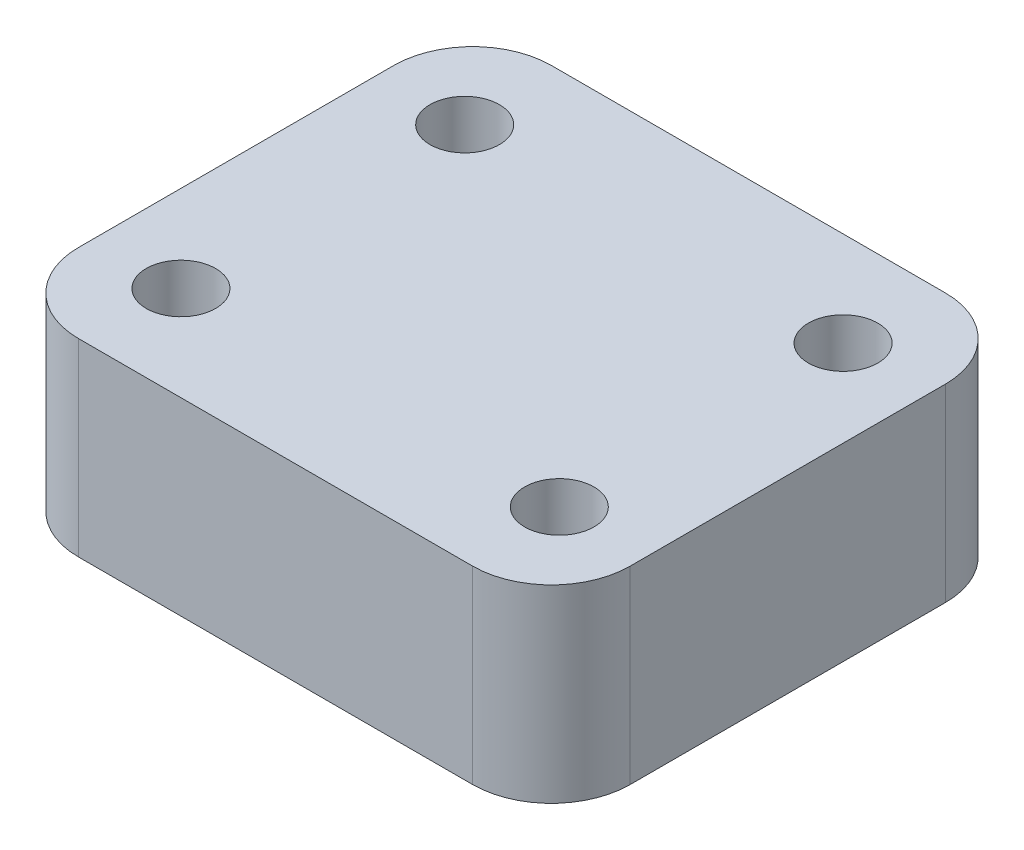
from build123d import *

# Parameters (mm, degrees)
SKETCH1_W           = 35
SKETCH1_H           = 30
BOSS_EXTRUDE1_DEPTH = 12
SKETCH2_R           = 2.2
CUT_EXTRUDE1_DEPTH  = 26.98557292
FILLET1_R           = 5


with BuildPart() as part:
    # Sketch1 → Boss-Extrude1 (new body)
    with BuildSketch(Plane(origin=(0, 0, 0), x_dir=(1, 0, 0), z_dir=(0, 1, 0))):
        Rectangle(SKETCH1_W, SKETCH1_H)
    extrude(amount=BOSS_EXTRUDE1_DEPTH)

    # Sketch2 → Cut-Extrude1 (cut, through all)
    with BuildSketch(Plane(origin=(0, 12, 0), x_dir=(1, 0, 0), z_dir=(0, 1, 0))):
        with Locations(Location((-12, 9, 0), (0, 0, 270))):
            Circle(SKETCH2_R)
        with Locations(Location((12, 9, 0), (0, 0, 270))):
            Circle(SKETCH2_R)
        with Locations(Location((12, -9, 0), (0, 0, 270))):
            Circle(SKETCH2_R)
        with Locations(Location((-12, -9, 0), (0, 0, 270))):
            Circle(SKETCH2_R)
    extrude(amount=-CUT_EXTRUDE1_DEPTH, mode=Mode.SUBTRACT)

    # Fillet1
    fillet1_edges = [part.edges().sort_by_distance(p)[0] for p in [
        (17.5, 6, 15),
        (-17.5, 6, 15),
        (-17.5, 6, -15),
        (17.5, 6, -15),
    ]]
    fillet(fillet1_edges, radius=FILLET1_R)


solid = part.part
